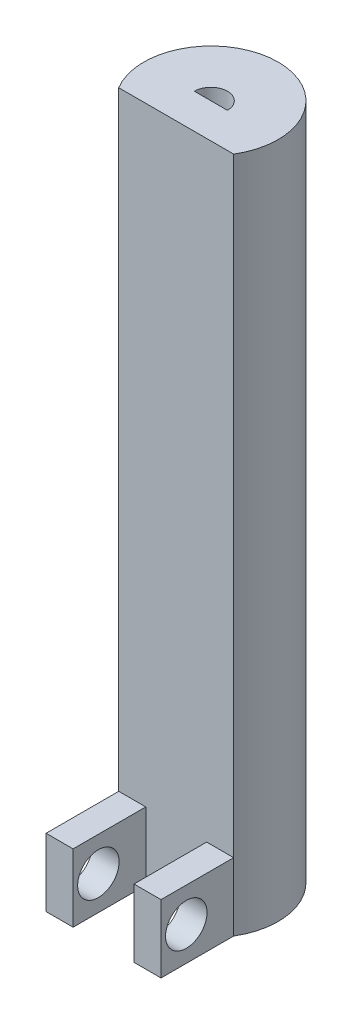
from build123d import *

# Parameters (mm, degrees)
SKETCH1_R           = 12.62515314
BOSS_EXTRUDE1_DEPTH = 127.254
SKETCH2_W           = 21.600890372
SKETCH2_H           = 6.08719661
CUT_EXTRUDE1_DEPTH  = 155.702
CUT_EXTRUDE2_DEPTH  = 141.081655767
SKETCH4_W           = 5.08
SKETCH4_H           = 13.653478909
BOSS_EXTRUDE2_DEPTH = 12.755190121
CUT_EXTRUDE3_REACH  = 132.958
SKETCH15_R          = 3.895516075


with BuildPart() as part:
    # Sketch1 → Boss-Extrude1 (new body)
    with BuildSketch(Plane(origin=(0, 0, 0), x_dir=(1, 0, 0), z_dir=(0, 1, 0))):
        with Locations(Location((0, 0, 0), (0, 0, 270))):
            Circle(SKETCH1_R)
    extrude(amount=-BOSS_EXTRUDE1_DEPTH)

    # Sketch2 → Cut-Extrude1 (cut)
    with BuildSketch(Plane(origin=(0, -127.254, 0), x_dir=(-1, 0, 0), z_dir=(0, -1, 0))):
        with Locations((0, -9.581554835)):
            Rectangle(SKETCH2_W, SKETCH2_H)
    extrude(amount=-CUT_EXTRUDE1_DEPTH, mode=Mode.SUBTRACT)

    # Sketch3 → Cut-Extrude2 (cut)
    with BuildSketch(Plane(origin=(0, -127.254, 0), x_dir=(-1, 0, 0), z_dir=(0, -1, 0))):
        with BuildLine():
            Line((3.126169088, 0), (-3.091625783, 0))
            ThreePointArc((-3.091625783, 0), (0.017271652, 3.108897435), (3.126169088, 0))
        make_face()
    extrude(amount=-CUT_EXTRUDE2_DEPTH, mode=Mode.SUBTRACT)

    # Sketch4 → Boss-Extrude2 (add)
    with BuildSketch(Plane.XZ.offset(127.254)):
        with Locations((-8.260445186, 13.364695985)):
            Rectangle(SKETCH4_W, SKETCH4_H)
    boss_extrude2 = extrude(amount=-BOSS_EXTRUDE2_DEPTH)

    # Sketch15 → Cut-Extrude3 (cut, up to next)
    with BuildSketch(Plane.ZY.offset(10.800445186), mode=Mode.PRIVATE) as cut_extrude3_sk1:
        with Locations((15.440577286, -120.904)):
            Circle(SKETCH15_R)
    cut_extrude3_tool1 = extrude(cut_extrude3_sk1.sketch, amount=-CUT_EXTRUDE3_REACH, mode=Mode.PRIVATE) & part.part
    cut_extrude3 = cut_extrude3_tool1.solids().sort_by_distance((-10.800445, -120.904, 15.440577))[0]
    add(cut_extrude3, mode=Mode.SUBTRACT)

    # Mirror2: Boss-Extrude2, Cut-Extrude3 across plane
    add(boss_extrude2.mirror(Plane(origin=(0, 0, 0), x_dir=(0, 0, 1), z_dir=(1, 0, 0))))
    add(cut_extrude3.mirror(Plane(origin=(0, 0, 0), x_dir=(0, 0, 1), z_dir=(1, 0, 0))), mode=Mode.SUBTRACT)


solid = part.part
